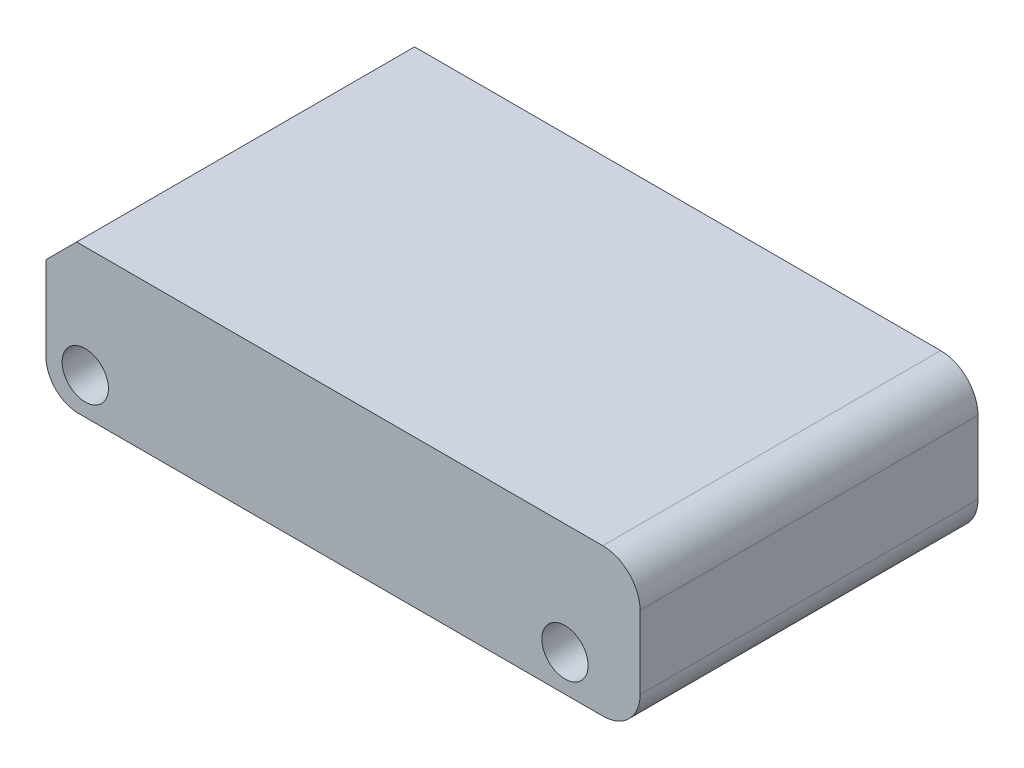
from build123d import *

# Parameters (mm, degrees)
SKETCH1_R           = 6.439788541
BOSS_EXTRUDE3_DEPTH = 93.98


with BuildPart() as part:
    # Sketch1 → Boss-Extrude3 (new body)
    with BuildSketch(Plane.XY):
        with BuildLine():
            Line((-88.871195362, 30.911720126), (57.437556069, 30.911720126))
            ThreePointArc((57.437556069, 30.911720126), (64.778520858, 27.870992949), (67.819248035, 20.53002816))
            Line((67.819248035, 20.53002816), (67.819248035, 0.255438821))
            ThreePointArc((67.819248035, 0.255438821), (64.778520858, -7.085525968), (57.437556069, -10.126253145))
            Line((57.437556069, -10.126253145), (-88.327193145, -10.126253145))
            ThreePointArc((-88.327193145, -10.126253145), (-94.733815173, -7.472543412), (-97.387524906, -1.065921384))
            Line((-97.387524906, -1.065921384), (-97.387524906, 22.395390582))
            Line((-97.387524906, 22.395390582), (-88.871195362, 30.911720126))
        make_face()
        with Locations((-86.472872248, 0)):
            Circle(SKETCH1_R, mode=Mode.SUBTRACT)
        with Locations((46.939064733, 0)):
            Circle(SKETCH1_R, mode=Mode.SUBTRACT)
    extrude(amount=-BOSS_EXTRUDE3_DEPTH)


solid = part.part
